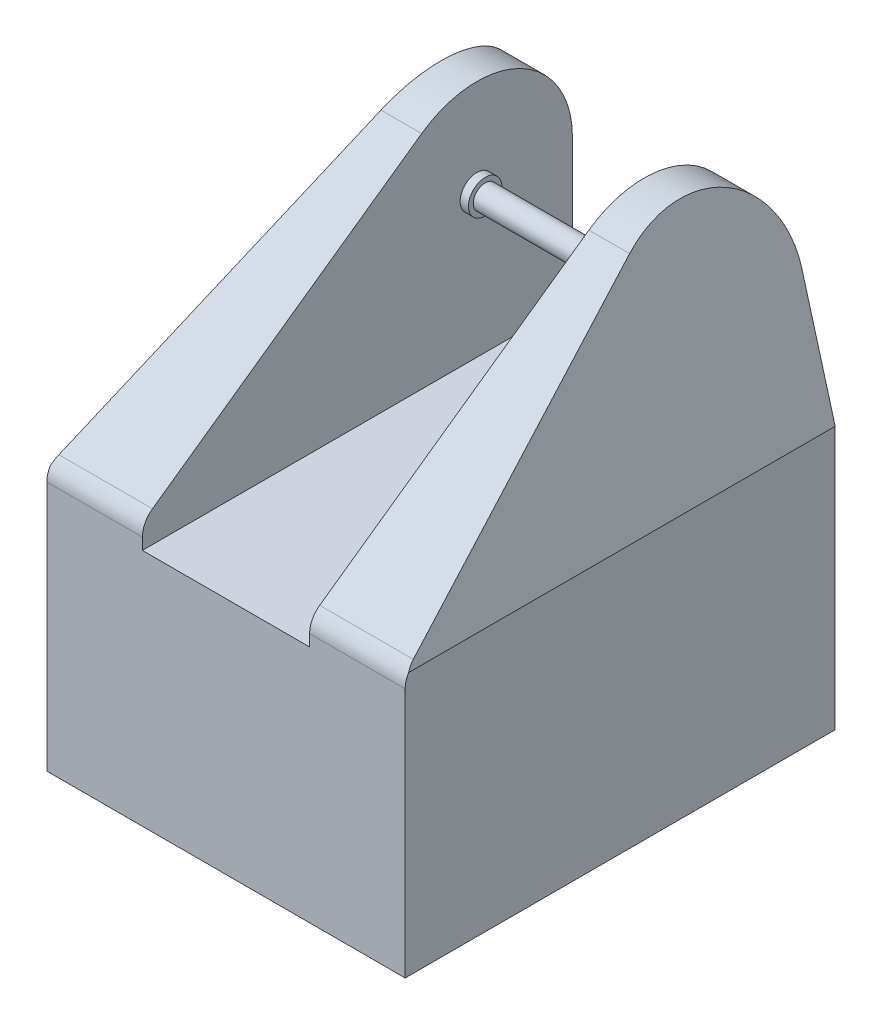
from build123d import *

# Parameters (mm, degrees)
EXTRUDE_1_DEPTH         = 150
FILLET_1_R              = 10
CUT_EXTRUDE_1_DEPTH     = 309.058436015
SKETCH1_R               = 12.5
CUT_EXTRUDE1_DEPTH      = 10
CUT_EXTRUDE2_DEPTH      = 80
CUT_EXTRUDE2_DEPTH_BACK = 10
SKETCH2_R               = 5
SKETCH4_R               = 12.5
SKETCH4_R_2             = 11.405
BOSS_EXTRUDE1_DEPTH     = 10
SKETCH8_R               = 5
BOSS_EXTRUDE3_DEPTH     = 90
SKETCH9_R               = 7
SKETCH9_R_2             = 5
BOSS_EXTRUDE4_DEPTH     = 3.5
BOSS_EXTRUDE5_START     = 3.5
SKETCH10_R              = 7
SKETCH10_R_2            = 5
BOSS_EXTRUDE5_DEPTH     = 3.5


with BuildPart() as part:
    # 草圖1 → 填料-伸長1 (new body)
    with BuildSketch(Plane(origin=(0, 0, 0), x_dir=(0, 0, -1), z_dir=(1, 0, 0))):
        with BuildLine():
            Line((0, 0), (0, 160))
            ThreePointArc((0, 160), (-21.611444176, 195.522683101), (-63.093050736, 192.660542061))
            Line((-63.093050736, 192.660542061), (-180, 110))
            Line((-180, 110), (-180, 0))
            Line((-180, 0), (0, 0))
        make_face()
    extrude(amount=EXTRUDE_1_DEPTH)

    # 圓角1
    fillet_1_edges = [part.edges().sort_by_distance(p)[0] for p in [
        (75, 110, 180),
    ]]
    fillet(fillet_1_edges, radius=FILLET_1_R)

    # 草圖2 → 除料-伸長1 (cut, through all)
    with BuildSketch(Plane(origin=(0, 0, 0), x_dir=(-1, 0, 0), z_dir=(0, 0, -1))):
        Polygon((-150, 110), (-125, 200), (-125, 212.317241835), (-176.077029544, 212.317241835), (-176.077029544, 111.407234288), align=None)
        Polygon((-110, 110), (-110, 202.916849344), (-40, 202.916849344), (-40, 110), (-40, 100), (-110, 100), align=None)
        Polygon((26.077029544, 111.407234288), (0, 110), (-25, 200), (-25, 212.317241835), (26.077029544, 212.317241835), align=None)
    extrude(amount=-CUT_EXTRUDE_1_DEPTH, mode=Mode.SUBTRACT)

    # Sketch1 → Cut-Extrude1 (cut)
    with BuildSketch(Plane.XZ):
        with Locations(Location((75, 40, 0), (0, 0, 270))):
            Circle(SKETCH1_R)
    extrude(amount=-CUT_EXTRUDE1_DEPTH, mode=Mode.SUBTRACT)

    # Sketch2 → Cut-Extrude2 (cut, two sides: drawn at the far end of the back side and taken through both)
    with BuildSketch(Plane(origin=(40, 0, 0), x_dir=(0, 0, -1), z_dir=(1, 0, 0)).offset(-CUT_EXTRUDE2_DEPTH_BACK)):
        with Locations(Location((-40, 160, 0), (0, 0, 270))):
            Circle(SKETCH2_R)
    extrude(amount=CUT_EXTRUDE2_DEPTH + CUT_EXTRUDE2_DEPTH_BACK, mode=Mode.SUBTRACT)

    # Sketch4 → Boss-Extrude1 (add)
    with BuildSketch(Plane.XZ):
        with Locations((75, 40)):
            Circle(SKETCH4_R)
        with Locations(Location((75, 40, 0), (0, 0, 270))):
            Circle(SKETCH4_R_2, mode=Mode.SUBTRACT)
    extrude(amount=-BOSS_EXTRUDE1_DEPTH)

    # Sketch8 → Boss-Extrude3 (add)
    with BuildSketch(Plane.ZY.offset(-120)):
        with Locations(Location((40, 160, 0), (0, 0, 90))):
            Circle(SKETCH8_R)
    extrude(amount=BOSS_EXTRUDE3_DEPTH)

    # Sketch9 → Boss-Extrude4 (add)
    with BuildSketch(Plane.ZY.offset(-110)):
        with Locations(Location((40, 160, 0), (0, 0, 180))):
            Circle(SKETCH9_R)
        with Locations((40, 160)):
            Circle(SKETCH9_R_2, mode=Mode.SUBTRACT)
    extrude(amount=BOSS_EXTRUDE4_DEPTH)

    # Sketch10 → Boss-Extrude5 (add)
    with BuildSketch(Plane(origin=(40, 0, 0), x_dir=(0, 0, -1), z_dir=(1, 0, 0)).offset(BOSS_EXTRUDE5_START)):
        with Locations((-40, 160)):
            Circle(SKETCH10_R)
        with Locations(Location((-40, 160, 0), (0, 0, 90))):
            Circle(SKETCH10_R_2, mode=Mode.SUBTRACT)
    extrude(amount=-BOSS_EXTRUDE5_DEPTH)


solid = part.part
